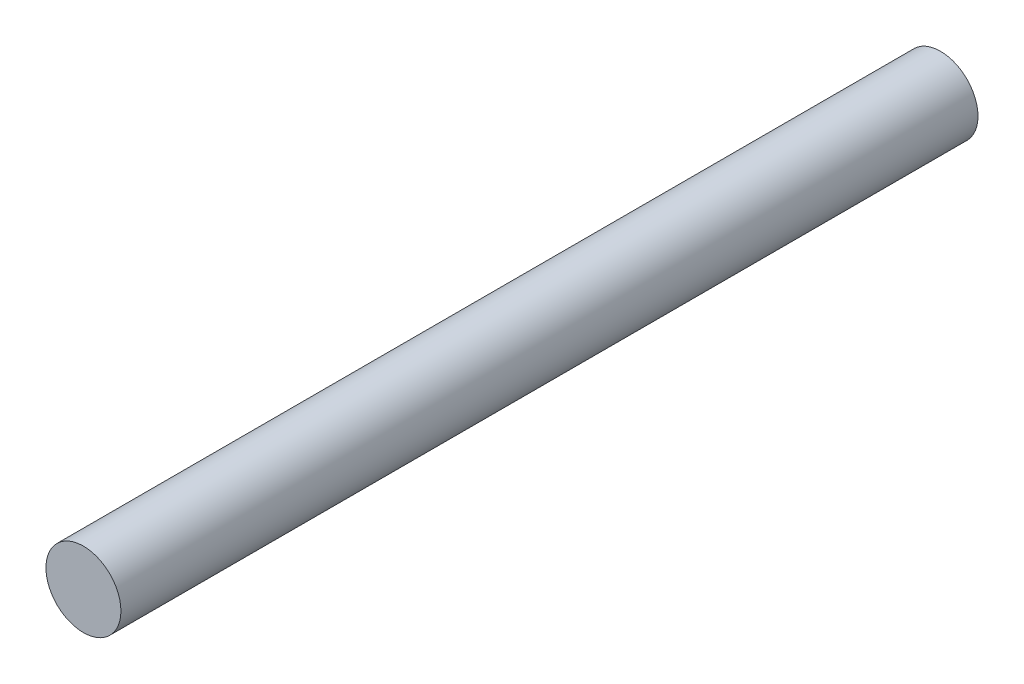
from build123d import *

# Parameters (mm, degrees)
SKETCH4_R           = 5
BOSS_EXTRUDE1_DEPTH = 114.3


with BuildPart() as part:
    # Sketch4 → Boss-Extrude1 (new body)
    with BuildSketch(Plane.XY.offset(88.9)):
        Circle(SKETCH4_R)
    extrude(amount=BOSS_EXTRUDE1_DEPTH)


solid = part.part
